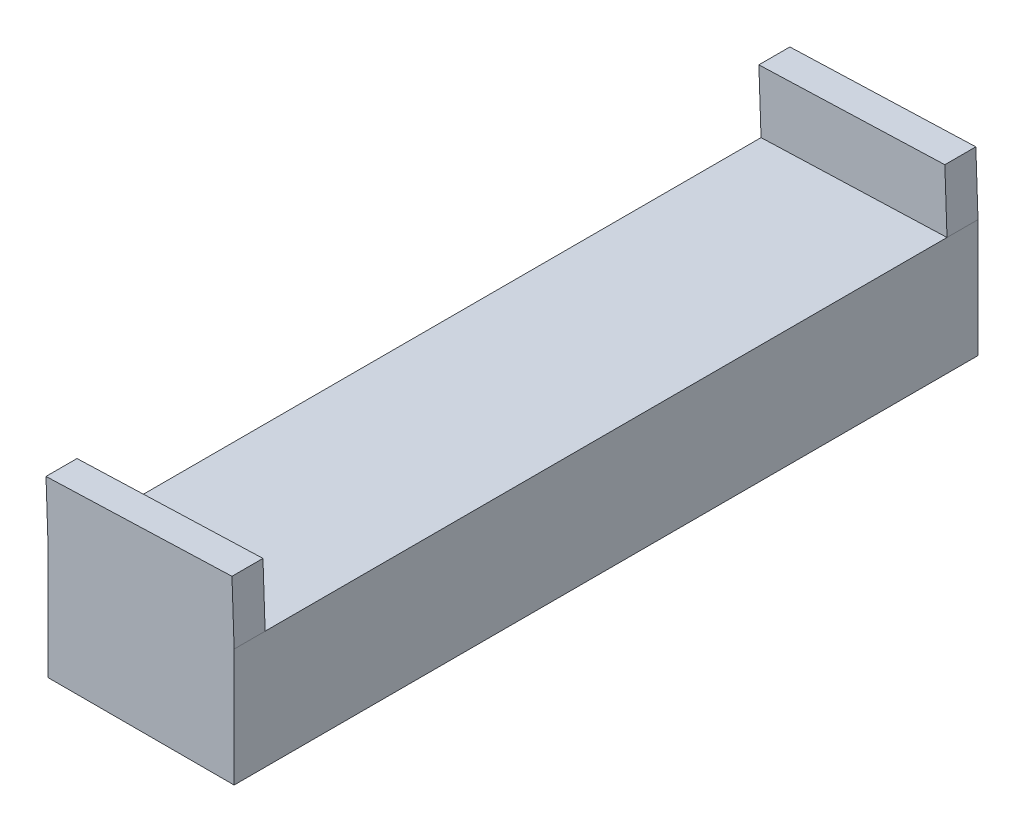
from build123d import *

# Parameters (mm, degrees)
SKETCH_1_W          = 30
SKETCH_1_H          = 120
EXTRUDE_1_DEPTH     = 19
CUT_EXTRUDE_1_DEPTH = 749.65857612
SKETCH_4_W          = 30.018286329
SKETCH_4_H          = 5
EXTRUDE_2_DEPTH     = 10


with BuildPart() as part:
    # Эскиз1 → Бобышка-Вытянуть1 (new body)
    with BuildSketch(Plane(origin=(708.734501427, 0, -6544.760847934), x_dir=(1, 0, 0), z_dir=(0, 1, 0))):
        with Locations((15, -60)):
            Rectangle(SKETCH_1_W, SKETCH_1_H)
    extrude(amount=EXTRUDE_1_DEPTH)

    # Эскиз3 → Вырез-Вытянуть1 (cut, through all)
    with BuildSketch(Plane.XY.offset(-6424.760847934)):
        Polygon((738.734501427, 19), (708.734501427, 17.952376915), (708.734501427, 19), align=None)
    extrude(amount=-CUT_EXTRUDE_1_DEPTH, mode=Mode.SUBTRACT)

    # Эскиз4 → Бобышка-Вытянуть2 (add)
    with BuildSketch(Plane(origin=(0.237073558, -6.788898449, 0), x_dir=(0.9993908270190961, 0.034899496702494016, 0), z_dir=(-0.034899496702494016, 0.9993908270190961, 0))):
        with Locations((723.938431602, 6542.260847934)):
            Rectangle(SKETCH_4_W, SKETCH_4_H)
        with Locations((723.938431602, 6427.260847934)):
            Rectangle(SKETCH_4_W, SKETCH_4_H)
    extrude(amount=EXTRUDE_2_DEPTH)


solid = part.part
